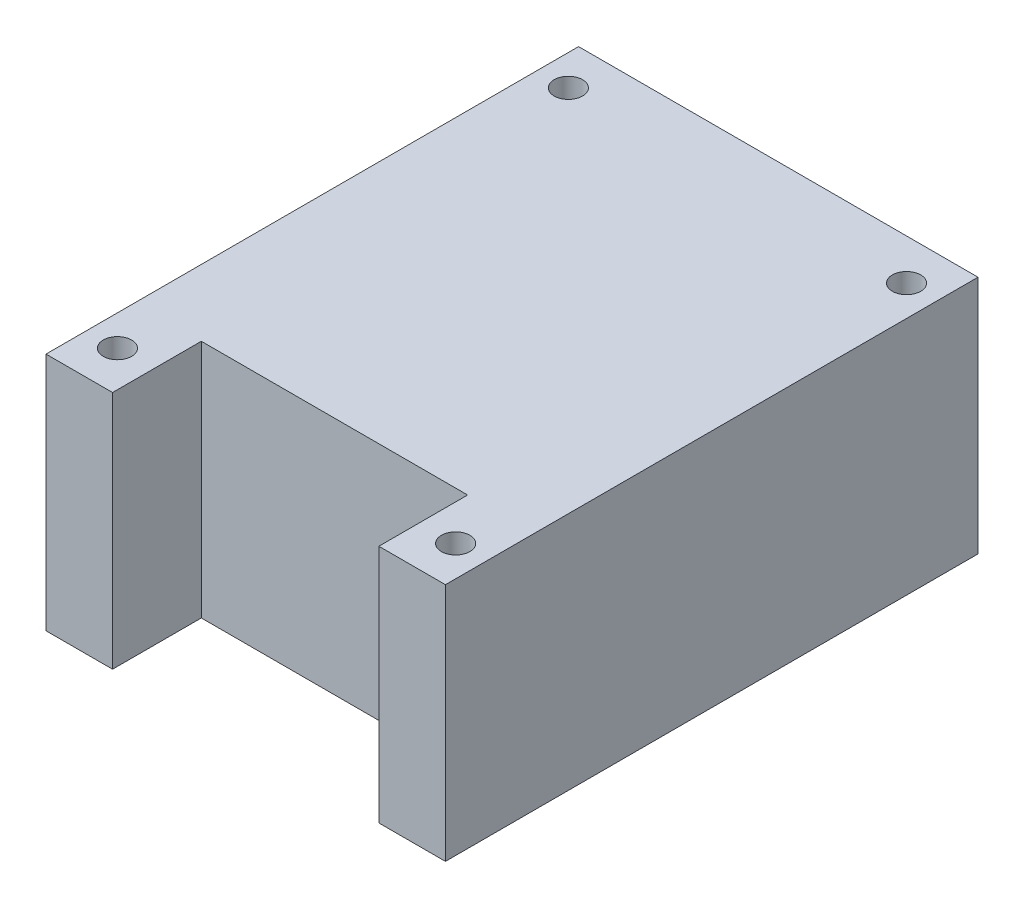
from build123d import *

# Parameters (mm, degrees)
ESQUISSE1_W             = 45
ESQUISSE1_H             = 60
BOSS_EXTRU_1_DEPTH      = 27
D_GAGEMENT_M31_D        = 3.2
ESQUISSE4_W             = 30
ESQUISSE4_H             = 10
ENL_V_MAT_EXTRU_1_DEPTH = 27


with BuildPart() as part:
    # Esquisse1 → Boss.-Extru.1 (new body)
    with BuildSketch(Plane(origin=(0, 0, 0), x_dir=(1, 0, 0), z_dir=(0, 1, 0))):
        Rectangle(ESQUISSE1_W, ESQUISSE1_H)
    extrude(amount=BOSS_EXTRU_1_DEPTH)

    # Dégagement M31 (through all)
    with Locations(Plane(origin=(0, 27, 0), x_dir=(1, 0, 0), z_dir=(0, 1, 0))):
        with Locations((-19.05, 25.4), (19.05, 25.4), (19.05, -25.4), (-19.05, -25.4)):
            Hole(D_GAGEMENT_M31_D / 2)

    # Esquisse4 → Enlèv. mat.-Extru.1 (cut)
    with BuildSketch(Plane.XZ):
        with Locations((0, 25)):
            Rectangle(ESQUISSE4_W, ESQUISSE4_H)
    extrude(amount=-ENL_V_MAT_EXTRU_1_DEPTH, mode=Mode.SUBTRACT)


solid = part.part
